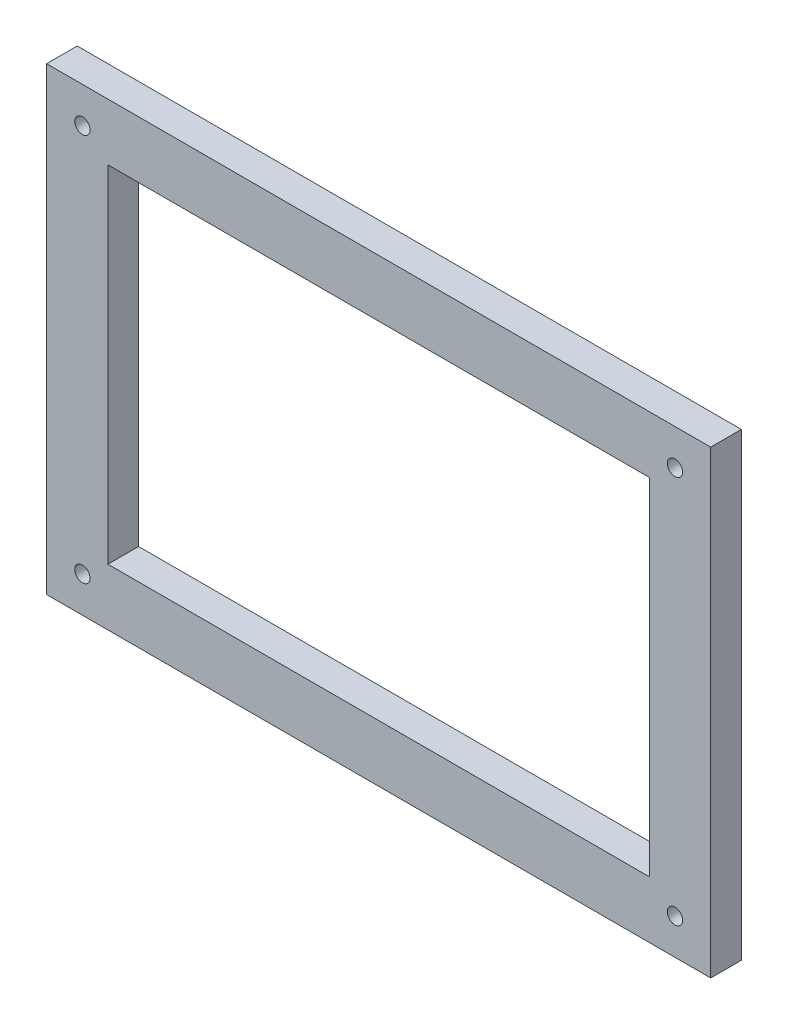
from build123d import *

# Parameters (mm, degrees)
SKETCH1_W             = 130
SKETCH1_H             = 90
SKETCH1_W_2           = 106
SKETCH1_H_2           = 67.7
BOSS_EXTRUDE1_DEPTH   = 6
F_3_0MM_DOWEL_HOLE1_D = 3


with BuildPart() as part:
    # Sketch1 → Boss-Extrude1 (new body)
    with BuildSketch(Plane.XY):
        with Locations((53, 33.85)):
            Rectangle(SKETCH1_W, SKETCH1_H)
        with Locations((53, 33.85)):
            Rectangle(SKETCH1_W_2, SKETCH1_H_2, mode=Mode.SUBTRACT)
    extrude(amount=BOSS_EXTRUDE1_DEPTH)

    # Ø3.0mm Dowel Hole1 (through all)
    with Locations(Plane.XY.offset(6)):
        with Locations((111, 71.85), (111, -4.15), (-5, -4.15), (-5, 71.85)):
            Hole(F_3_0MM_DOWEL_HOLE1_D / 2)


solid = part.part
